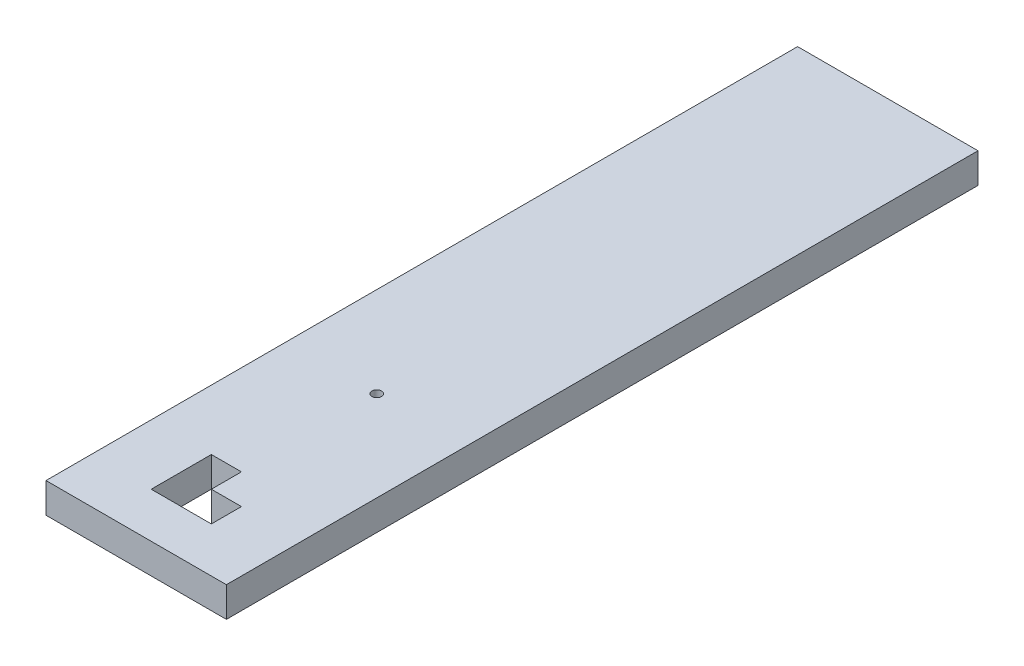
from build123d import *

# Parameters (mm, degrees)
SKETCH1_W           = 60
SKETCH1_H           = 250
SKETCH1_R           = 1.6
BOSS_EXTRUDE1_DEPTH = 10


with BuildPart() as part:
    # Sketch1 → Boss-Extrude1 (new body)
    with BuildSketch(Plane(origin=(0, 0, 0), x_dir=(1, 0, 0), z_dir=(0, 1, 0))):
        with Locations((30, -125)):
            Rectangle(SKETCH1_W, SKETCH1_H)
        with Locations(Location((30, -170, 0), (0, 0, 270))):
            Circle(SKETCH1_R, mode=Mode.SUBTRACT)
        Polygon((20, -215), (20, -235), (40, -235), (40, -225), (30, -225), (30, -215), align=None, mode=Mode.SUBTRACT)
    extrude(amount=BOSS_EXTRUDE1_DEPTH)


solid = part.part
